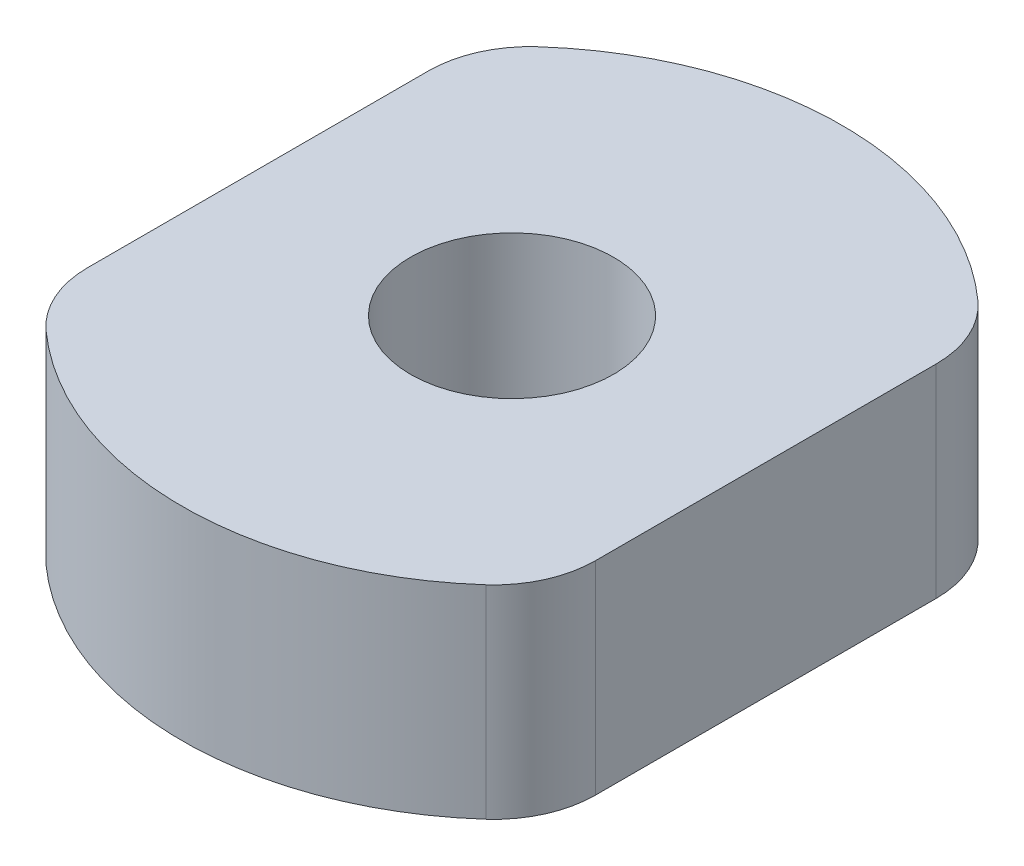
from build123d import *

# Parameters (mm, degrees)
SKETCH1_R      = 12.7
EXTRUDE2_DEPTH = 25.4


with BuildPart() as part:
    # Sketch1 → Extrude2 (new body)
    with BuildSketch(Plane(origin=(0, 0, 0), x_dir=(1, 0, 0), z_dir=(0, 1, 0))):
        with BuildLine():
            Line((-31.75, 21.298547486), (-31.75, -21.298547486))
            ThreePointArc((-31.75, -21.298547486), (-30.643460801, -26.483300775), (-27.516666667, -30.76456859))
            ThreePointArc((-27.516666667, -30.76456859), (0, -41.275), (27.516666667, -30.76456859))
            ThreePointArc((27.516666667, -30.76456859), (30.643460801, -26.483300775), (31.75, -21.298547486))
            Line((31.75, -21.298547486), (31.75, 21.298547486))
            ThreePointArc((31.75, 21.298547486), (30.643460801, 26.483300775), (27.516666667, 30.76456859))
            ThreePointArc((27.516666667, 30.76456859), (0, 41.275), (-27.516666667, 30.76456859))
            ThreePointArc((-27.516666667, 30.76456859), (-30.643460801, 26.483300775), (-31.75, 21.298547486))
        make_face()
        with Locations(Location((0, 0, 0), (0, 0, 270))):
            Circle(SKETCH1_R, mode=Mode.SUBTRACT)
    extrude(amount=EXTRUDE2_DEPTH)


solid = part.part
